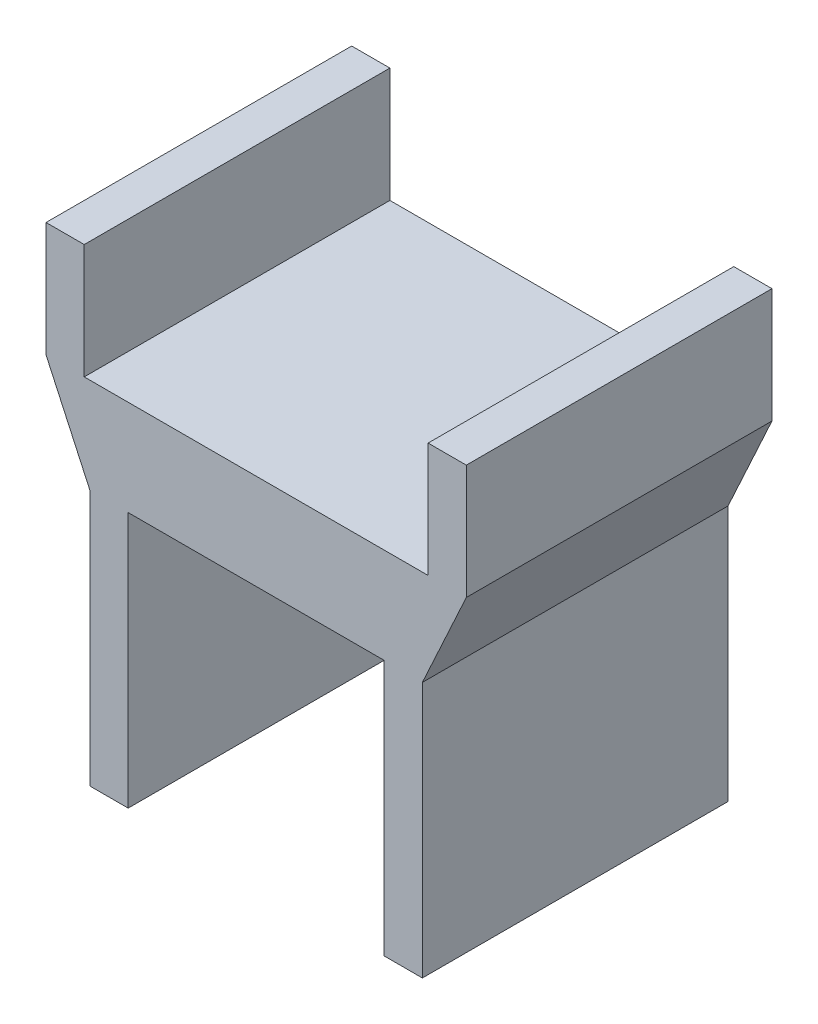
from build123d import *

# Parameters (mm, degrees)
CROQUIS1_W              = 2
CROQUIS1_H              = 13.4
CROQUIS1_H_2            = 6
SALIENTE_EXTRUIR1_DEPTH = 16


with BuildPart() as part:
    # Croquis1 → Saliente-Extruir1 (new body)
    with BuildSketch(Plane.XY):
        with Locations((-1, -6.7)):
            Rectangle(CROQUIS1_W, CROQUIS1_H)
        Polygon((15.4, 5), (6.7, 5), (-2, 5), (-2, 0), (0, 0), (13.4, 0), (15.4, 0), align=None)
        with Locations((14.4, -6.7)):
            Rectangle(CROQUIS1_W, CROQUIS1_H)
        Polygon((15.7, 5), (15.4, 5), (15.4, 0), (17.7, 5), align=None)
        with Locations((16.7, 8)):
            Rectangle(CROQUIS1_W, CROQUIS1_H_2)
        Polygon((-2, 0), (-2, 5), (-2.3, 5), (-4.3, 5), align=None)
        with Locations((-3.3, 8)):
            Rectangle(CROQUIS1_W, CROQUIS1_H_2)
    extrude(amount=SALIENTE_EXTRUIR1_DEPTH)


solid = part.part
